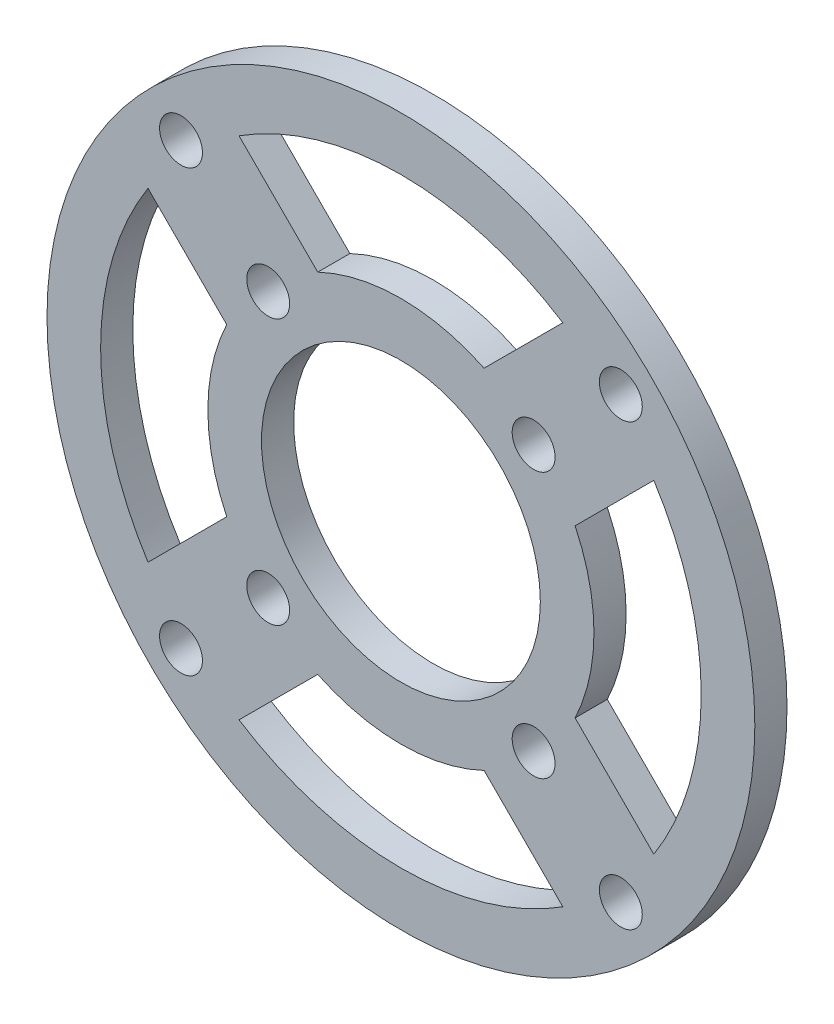
from build123d import *

# Parameters (mm, degrees)
SKETCH_1_R          = 33
SKETCH_1_R_2        = 2
SKETCH_1_R_3        = 13
EXTRUDE_1_DEPTH     = 3
CUT_EXTRUDE_1_DEPTH = 47.765371804


with BuildPart() as part:
    # 草图1 → 凸台-拉伸1 (new body)
    with BuildSketch(Plane.XY):
        Circle(SKETCH_1_R)
        with Locations((-20.506096654, 20.506096654)):
            Circle(SKETCH_1_R_2, mode=Mode.SUBTRACT)
        with Locations((20.506096654, 20.506096654)):
            Circle(SKETCH_1_R_2, mode=Mode.SUBTRACT)
        with Locations((20.506096654, -20.506096654)):
            Circle(SKETCH_1_R_2, mode=Mode.SUBTRACT)
        with Locations((-20.506096654, -20.506096654)):
            Circle(SKETCH_1_R_2, mode=Mode.SUBTRACT)
        with Locations((-12.374368671, 12.374368671)):
            Circle(SKETCH_1_R_2, mode=Mode.SUBTRACT)
        with Locations((12.374368671, 12.374368671)):
            Circle(SKETCH_1_R_2, mode=Mode.SUBTRACT)
        with Locations((12.374368671, -12.374368671)):
            Circle(SKETCH_1_R_2, mode=Mode.SUBTRACT)
        with Locations((-12.374368671, -12.374368671)):
            Circle(SKETCH_1_R_2, mode=Mode.SUBTRACT)
        Circle(SKETCH_1_R_3, mode=Mode.SUBTRACT)
    extrude(amount=EXTRUDE_1_DEPTH)

    # 草图2 → 切除-拉伸1 (cut, through all)
    with BuildSketch(Plane.XY.offset(3)):
        with BuildLine():
            Line((-7.757359313, 16.242640687), (-15.096438919, 23.581720293))
            ThreePointArc((-15.096438919, 23.581720293), (0, 28), (15.096438919, 23.581720293))
            Line((15.096438919, 23.581720293), (7.757359313, 16.242640687))
            ThreePointArc((7.757359313, 16.242640687), (0, 18), (-7.757359313, 16.242640687))
        make_face()
        with BuildLine():
            Line((16.242640687, 7.757359313), (23.581720293, 15.096438919))
            ThreePointArc((23.581720293, 15.096438919), (28, 0), (23.581720293, -15.096438919))
            Line((23.581720293, -15.096438919), (16.242640687, -7.757359313))
            ThreePointArc((16.242640687, -7.757359313), (18, 0), (16.242640687, 7.757359313))
        make_face()
        with BuildLine():
            Line((7.757359313, -16.242640687), (15.096438919, -23.581720293))
            ThreePointArc((15.096438919, -23.581720293), (0, -28), (-15.096438919, -23.581720293))
            Line((-15.096438919, -23.581720293), (-7.757359313, -16.242640687))
            ThreePointArc((-7.757359313, -16.242640687), (0, -18), (7.757359313, -16.242640687))
        make_face()
        with BuildLine():
            Line((-16.242640687, -7.757359313), (-23.581720293, -15.096438919))
            ThreePointArc((-23.581720293, -15.096438919), (-28, 0), (-23.581720293, 15.096438919))
            Line((-23.581720293, 15.096438919), (-16.242640687, 7.757359313))
            ThreePointArc((-16.242640687, 7.757359313), (-18, 0), (-16.242640687, -7.757359313))
        make_face()
    extrude(amount=-CUT_EXTRUDE_1_DEPTH, mode=Mode.SUBTRACT)


solid = part.part
